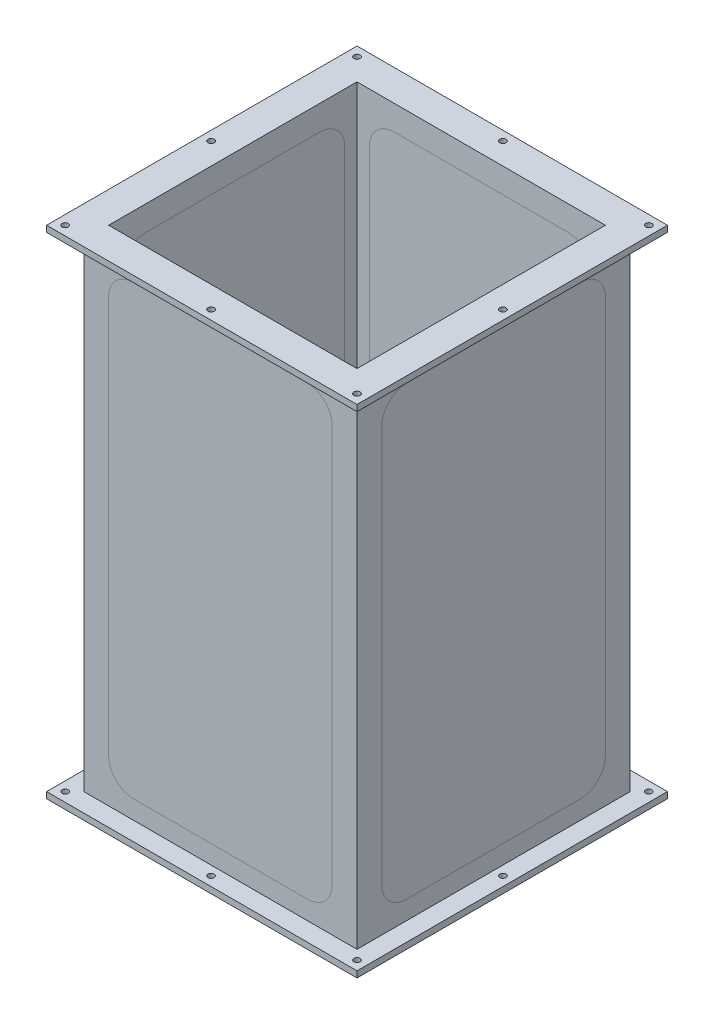
from build123d import *

# Parameters (mm, degrees)
SKETCH1_W           = 220
SKETCH1_H           = 220
SKETCH1_W_2         = 200
SKETCH1_H_2         = 200
BOSS_EXTRUDE1_DEPTH = 400
CUT_EXTRUDE1_DEPTH  = 2000
CUT_EXTRUDE2_DEPTH  = 2000
BOSS_EXTRUDE2_DEPTH = 10
CIRPATTERN2_COUNT   = 4
SKETCH8_W           = 250
SKETCH8_H           = 250
SKETCH8_R           = 2.5
SKETCH8_W_2         = 200
SKETCH8_H_2         = 200
BOSS_EXTRUDE3_DEPTH = 5


with BuildPart() as part:
    # Sketch1 → Boss-Extrude1 (new body)
    with BuildSketch(Plane(origin=(0, 0, 0), x_dir=(1, 0, 0), z_dir=(0, 1, 0))):
        Rectangle(SKETCH1_W, SKETCH1_H)
        Rectangle(SKETCH1_W_2, SKETCH1_H_2, mode=Mode.SUBTRACT)
    extrude(amount=BOSS_EXTRUDE1_DEPTH)

    # Sketch2 → Cut-Extrude1 (cut)
    with BuildSketch(Plane.XY.offset(110)):
        with BuildLine():
            Line((-70, 20), (70, 20))
            ThreePointArc((70, 20), (84.142135624, 25.857864376), (90, 40))
            Line((90, 40), (90, 360))
            ThreePointArc((90, 360), (84.142135624, 374.142135624), (70, 380))
            Line((70, 380), (-70, 380))
            ThreePointArc((-70, 380), (-84.142135624, 374.142135624), (-90, 360))
            Line((-90, 360), (-90, 40))
            ThreePointArc((-90, 40), (-84.142135624, 25.857864376), (-70, 20))
        make_face()
    extrude(amount=-CUT_EXTRUDE1_DEPTH, mode=Mode.SUBTRACT)

    # Sketch3 → Cut-Extrude2 (cut)
    with BuildSketch(Plane(origin=(110, 0, 0), x_dir=(0, 0, -1), z_dir=(1, 0, 0))):
        with BuildLine():
            Line((-70, 20), (70, 20))
            ThreePointArc((70, 20), (84.142135624, 25.857864376), (90, 40))
            Line((90, 40), (90, 360))
            ThreePointArc((90, 360), (84.142135624, 374.142135624), (70, 380))
            Line((70, 380), (-70, 380))
            ThreePointArc((-70, 380), (-84.142135624, 374.142135624), (-90, 360))
            Line((-90, 360), (-90, 40))
            ThreePointArc((-90, 40), (-84.142135624, 25.857864376), (-70, 20))
        make_face()
    extrude(amount=-CUT_EXTRUDE2_DEPTH, mode=Mode.SUBTRACT)

    # Sketch8 → Boss-Extrude3 (add)
    with BuildSketch(Plane(origin=(0, 400, 0), x_dir=(1, 0, 0), z_dir=(0, 1, 0))):
        Rectangle(SKETCH8_W, SKETCH8_H)
        with Locations(Location((-117.5, 117.5, 0), (0, 0, 270))):
            Circle(SKETCH8_R, mode=Mode.SUBTRACT)
        with Locations(Location((0, 117.5, 0), (0, 0, 270))):
            Circle(SKETCH8_R, mode=Mode.SUBTRACT)
        with Locations(Location((117.5, 117.5, 0), (0, 0, 90))):
            Circle(SKETCH8_R, mode=Mode.SUBTRACT)
        with Locations(Location((117.5, 0, 0), (0, 0, 90))):
            Circle(SKETCH8_R, mode=Mode.SUBTRACT)
        with Locations(Location((117.5, -117.5, 0), (0, 0, 90))):
            Circle(SKETCH8_R, mode=Mode.SUBTRACT)
        with Locations(Location((-117.5, 0, 0), (0, 0, 270))):
            Circle(SKETCH8_R, mode=Mode.SUBTRACT)
        with Locations(Location((-117.5, -117.5, 0), (0, 0, 270))):
            Circle(SKETCH8_R, mode=Mode.SUBTRACT)
        with Locations(Location((0, -117.5, 0), (0, 0, 90))):
            Circle(SKETCH8_R, mode=Mode.SUBTRACT)
        Rectangle(SKETCH8_W_2, SKETCH8_H_2, mode=Mode.SUBTRACT)
    boss_extrude3 = extrude(amount=-BOSS_EXTRUDE3_DEPTH)

    # Mirror1: Boss-Extrude3 across plane
    add(boss_extrude3.mirror(Plane.ZX.offset(200)))


with BuildPart() as body_2:
    # Sketch5 → Boss-Extrude2 (new body)
    with BuildSketch(Plane.XY.offset(110)):
        with BuildLine():
            Line((-70, 20), (70, 20))
            ThreePointArc((70, 20), (84.142135624, 25.857864376), (90, 40))
            Line((90, 40), (90, 360))
            ThreePointArc((90, 360), (84.142135624, 374.142135624), (70, 380))
            Line((70, 380), (-70, 380))
            ThreePointArc((-70, 380), (-84.142135624, 374.142135624), (-90, 360))
            Line((-90, 360), (-90, 40))
            ThreePointArc((-90, 40), (-84.142135624, 25.857864376), (-70, 20))
        make_face()
    extrude(amount=-BOSS_EXTRUDE2_DEPTH)


with BuildPart() as cirpattern2_1:
    # CirPattern2: pattern copy
    add(body_2.part.rotate(Axis((0, 0, 0), (0, 1, 0)), 1 * 360 / CIRPATTERN2_COUNT))


with BuildPart() as cirpattern2_2:
    # CirPattern2: pattern copy
    add(body_2.part.rotate(Axis((0, 0, 0), (0, 1, 0)), 2 * 360 / CIRPATTERN2_COUNT))


with BuildPart() as cirpattern2_3:
    # CirPattern2: pattern copy
    add(body_2.part.rotate(Axis((0, 0, 0), (0, 1, 0)), 3 * 360 / CIRPATTERN2_COUNT))


solid = Compound([part.part, body_2.part, cirpattern2_1.part, cirpattern2_2.part, cirpattern2_3.part])
